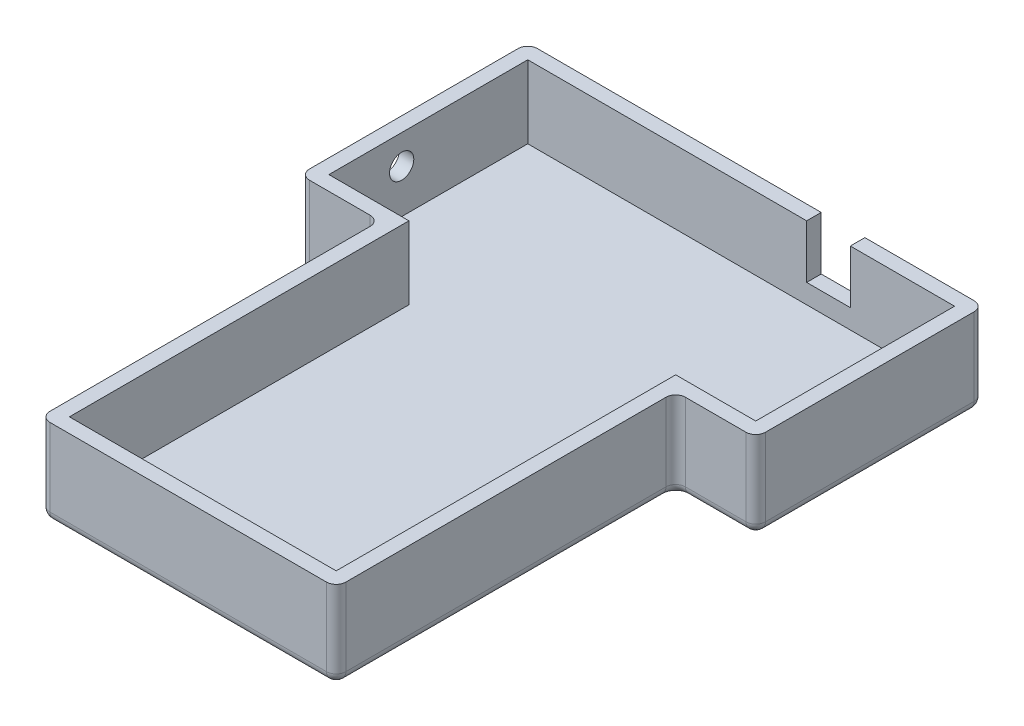
from build123d import *

# Parameters (mm, degrees)
BOSS_EXTRUDE1_DEPTH = 15
SHELL1_T            = 3
SKETCH3_W           = 9
SKETCH3_H           = 11
CUT_EXTRUDE1_DEPTH  = 3
SKETCH4_R           = 2.5
CUT_EXTRUDE2_DEPTH  = 3
FILLET1_R           = 2


with BuildPart() as part:
    # Sketch1 → Boss-Extrude1 (new body)
    with BuildSketch(Plane(origin=(0, 0, 0), x_dir=(1, 0, 0), z_dir=(0, 1, 0))):
        Polygon((0, 0), (88, 0), (88, -41), (71.5, -41), (71.5, -111), (16.5, -111), (16.5, -41), (0, -41), align=None)
    extrude(amount=BOSS_EXTRUDE1_DEPTH)

    # Shell1
    shell1_openings = [part.faces().sort_by_distance(p)[0] for p in [
        (44, 15, 49.150442478),
    ]]
    offset(amount=SHELL1_T, openings=shell1_openings, kind=Kind.INTERSECTION)

    # Sketch3 → Cut-Extrude1 (cut)
    with BuildSketch(Plane(origin=(0, 0, -3), x_dir=(-1, 0, 0), z_dir=(0, 0, -1))):
        with Locations((-62, 9.5)):
            Rectangle(SKETCH3_W, SKETCH3_H)
    extrude(amount=-CUT_EXTRUDE1_DEPTH, mode=Mode.SUBTRACT)

    # Sketch4 → Cut-Extrude2 (cut)
    with BuildSketch(Plane.ZY.offset(3)):
        with Locations((26, 9)):
            Circle(SKETCH4_R)
    extrude(amount=-CUT_EXTRUDE2_DEPTH, mode=Mode.SUBTRACT)

    # Fillet1
    fillet1_edges = [part.edges().sort_by_distance(p)[0] for p in [
        (44, -3, 114),
        (13.5, -3, 79),
        (5.25, -3, 44),
        (-3, -3, 20.5),
        (-3, 6, -3),
        (91, 6, -3),
        (91, 6, 44),
        (74.5, 6, 44),
        (74.5, 6, 114),
        (13.5, 6, 114),
        (13.5, 6, 44),
        (-3, 6, 44),
        (44, -3, -3),
        (91, -3, 20.5),
        (82.75, -3, 44),
        (74.5, -3, 79),
    ]]
    fillet(fillet1_edges, radius=FILLET1_R)


solid = part.part
